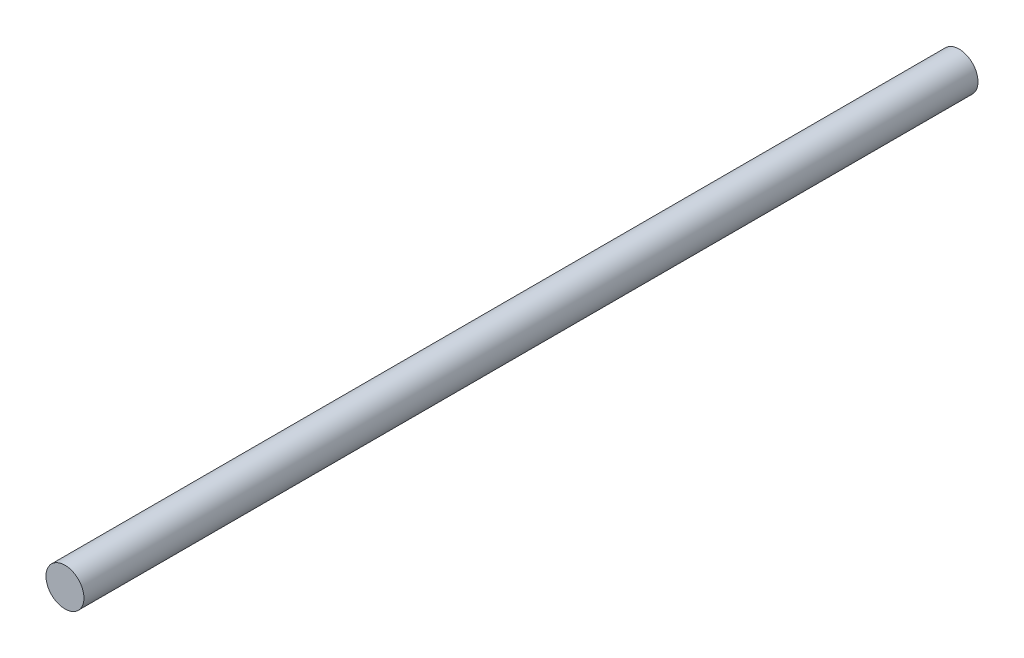
from build123d import *

# Parameters (mm, degrees)
CROQUIS1_R              = 1.25
SALIENTE_EXTRUIR1_DEPTH = 58.9


with BuildPart() as part:
    # Croquis1 → Saliente-Extruir1 (new body)
    with BuildSketch(Plane.XY):
        Circle(CROQUIS1_R)
    extrude(amount=-SALIENTE_EXTRUIR1_DEPTH)


solid = part.part
